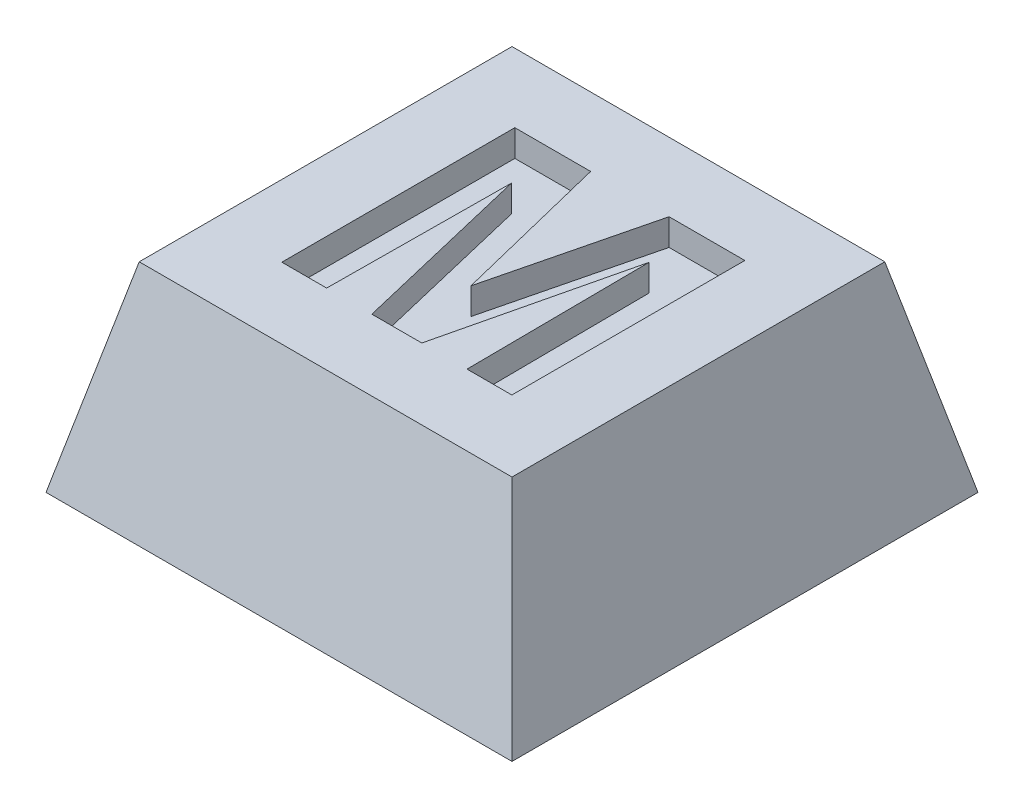
from build123d import *

# Parameters (mm, degrees)
SKETCH1_W           = 7
SKETCH1_H           = 7
BOSS_EXTRUDE1_DEPTH = 3
CUT_EXTRUDE1_DEPTH  = 7
CUT_EXTRUDE2_DEPTH  = 11
SKETCH4_R           = 1.8
CUT_EXTRUDE3_DEPTH  = 0.8
CUT_EXTRUDE4_DEPTH  = 0.4


with BuildPart() as part:
    # Sketch1 → Boss-Extrude1 (new body)
    with BuildSketch(Plane(origin=(0, 0, 0), x_dir=(1, 0, 0), z_dir=(0, 1, 0))):
        with Locations((3.5, 3.5)):
            Rectangle(SKETCH1_W, SKETCH1_H)
    extrude(amount=BOSS_EXTRUDE1_DEPTH)

    # Sketch2 → Cut-Extrude1 (cut)
    with BuildSketch(Plane.XY):
        Polygon((0, 0), (0.7, 3), (0, 3), align=None)
        Polygon((7, 0), (6.3, 3), (7, 3), align=None)
    extrude(amount=-CUT_EXTRUDE1_DEPTH, mode=Mode.SUBTRACT)

    # Sketch3 → Cut-Extrude2 (cut)
    with BuildSketch(Plane(origin=(0, 0, 0), x_dir=(0, 0, -1), z_dir=(1, 0, 0))):
        Polygon((0, 0), (0.7, 3), (0, 3), align=None)
        Polygon((7, 3), (6.3, 3), (7, 0), align=None)
    extrude(amount=CUT_EXTRUDE2_DEPTH, mode=Mode.SUBTRACT)

    # Sketch4 → Cut-Extrude3 (cut)
    with BuildSketch(Plane.XZ):
        with Locations(Location((3.5, -3.5, 0), (0, 0, 270))):
            Circle(SKETCH4_R)
    extrude(amount=-CUT_EXTRUDE3_DEPTH, mode=Mode.SUBTRACT)

    # Sketch5 → Cut-Extrude4 (cut)
    with BuildSketch(Plane(origin=(0, 3, 0), x_dir=(1, 0, 0), z_dir=(0, 1, 0))):
        Polygon((1.77651834, 1.766029319), (1.77651834, 5.266029319), (2.915140135, 5.266029319), (3.504082443, 2.878709608), (4.09302475, 5.266029319), (5.231646545, 5.266029319), (5.231646545, 1.766029319), (4.558569622, 1.766029319), (4.536133725, 4.521437973), (3.879182603, 1.766029319), (3.128982282, 1.766029319), (2.47203116, 4.521437973), (2.449595263, 1.766029319), align=None)
    extrude(amount=-CUT_EXTRUDE4_DEPTH, mode=Mode.SUBTRACT)


solid = part.part
